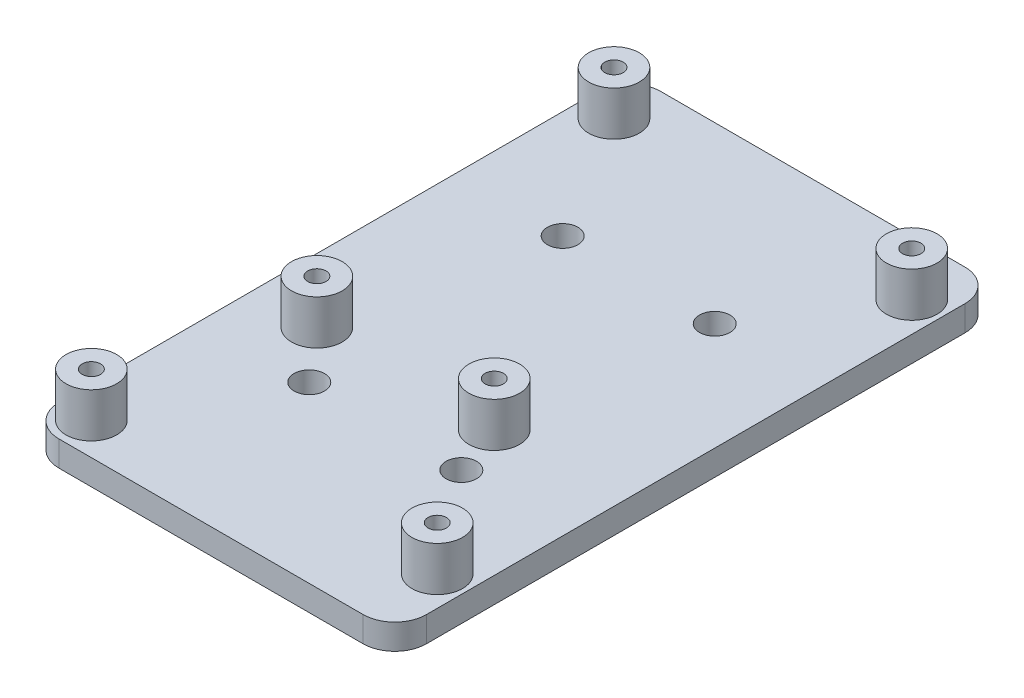
from build123d import *

# Parameters (mm, degrees)
SKETCH1_W           = 58
SKETCH1_H           = 95
BOSS_EXTRUDE1_DEPTH = 4
SKETCH2_R           = 4
SKETCH2_R_2         = 1.45
BOSS_EXTRUDE2_DEPTH = 7
FILLET1_R           = 5
CUT_EXTRUDE1_REACH  = 58.73
SKETCH3_R           = 2.4


with BuildPart() as part:
    # Sketch1 → Boss-Extrude1 (new body)
    with BuildSketch(Plane(origin=(0, 0, 0), x_dir=(1, 0, 0), z_dir=(0, 1, 0))):
        Rectangle(SKETCH1_W, SKETCH1_H)
    extrude(amount=BOSS_EXTRUDE1_DEPTH)

    # Sketch2 → Boss-Extrude2 (add)
    # profile 1 of 6: a face of its own
    with BuildSketch(Plane(origin=(0, 4, 0), x_dir=(1, 0, 0), z_dir=(0, 1, 0))):
        with Locations(Location((-24, 40.1, 0), (0, 0, 270))):
            Circle(SKETCH2_R)
        with Locations(Location((-24, 40.1, 0), (0, 0, 270))):
            Circle(SKETCH2_R_2, mode=Mode.SUBTRACT)
    # profile 2 of 6: a face of its own
    with BuildSketch(Plane(origin=(0, 4, 0), x_dir=(1, 0, 0), z_dir=(0, 1, 0))):
        with Locations(Location((24.25, 38.85, 0), (0, 0, 270))):
            Circle(SKETCH2_R)
        with Locations(Location((24.25, 38.85, 0), (0, 0, 270))):
            Circle(SKETCH2_R_2, mode=Mode.SUBTRACT)
    # profile 3 of 6: a face of its own
    with BuildSketch(Plane(origin=(0, 4, 0), x_dir=(1, 0, 0), z_dir=(0, 1, 0))):
        with Locations(Location((-18.9, -11.9, 0), (0, 0, 270))):
            Circle(SKETCH2_R)
        with Locations(Location((-18.9, -11.9, 0), (0, 0, 270))):
            Circle(SKETCH2_R_2, mode=Mode.SUBTRACT)
    # profile 4 of 6: a face of its own
    with BuildSketch(Plane(origin=(0, 4, 0), x_dir=(1, 0, 0), z_dir=(0, 1, 0))):
        with Locations(Location((9.1, -11.9, 0), (0, 0, 270))):
            Circle(SKETCH2_R)
        with Locations(Location((9.1, -11.9, 0), (0, 0, 270))):
            Circle(SKETCH2_R_2, mode=Mode.SUBTRACT)
    # profile 5 of 6: a face of its own
    with BuildSketch(Plane(origin=(0, 4, 0), x_dir=(1, 0, 0), z_dir=(0, 1, 0))):
        with Locations(Location((-24, -42.4, 0), (0, 0, 270))):
            Circle(SKETCH2_R)
        with Locations(Location((-24, -42.4, 0), (0, 0, 270))):
            Circle(SKETCH2_R_2, mode=Mode.SUBTRACT)
    # profile 6 of 6: a face of its own
    with BuildSketch(Plane(origin=(0, 4, 0), x_dir=(1, 0, 0), z_dir=(0, 1, 0))):
        with Locations(Location((24.3, -36.1, 0), (0, 0, 270))):
            Circle(SKETCH2_R)
        with Locations(Location((24.3, -36.1, 0), (0, 0, 270))):
            Circle(SKETCH2_R_2, mode=Mode.SUBTRACT)
    extrude(amount=BOSS_EXTRUDE2_DEPTH)

    # Fillet1
    fillet1_edges = [part.edges().sort_by_distance(p)[0] for p in [
        (29, 2, 47.5),
        (-29, 2, 47.5),
        (-29, 2, -47.5),
        (29, 2, -47.5),
    ]]
    fillet(fillet1_edges, radius=FILLET1_R)

    # Sketch3 → Cut-Extrude1 (cut, up to next)
    with BuildSketch(Plane(origin=(0, 0, 0), x_dir=(1, 0, 0), z_dir=(0, 1, 0)), mode=Mode.PRIVATE) as cut_extrude1_sk1:
        with Locations(Location((-12, 20, 0), (0, 0, 270))):
            Circle(SKETCH3_R)
    cut_extrude1_tool1 = extrude(cut_extrude1_sk1.sketch, amount=CUT_EXTRUDE1_REACH, mode=Mode.PRIVATE) & part.part
    # Sketch3 → Cut-Extrude1 (cut, up to next)
    with BuildSketch(Plane(origin=(0, 0, 0), x_dir=(1, 0, 0), z_dir=(0, 1, 0)), mode=Mode.PRIVATE) as cut_extrude1_sk2:
        with Locations(Location((12, 20, 0), (0, 0, 270))):
            Circle(SKETCH3_R)
    cut_extrude1_tool2 = extrude(cut_extrude1_sk2.sketch, amount=CUT_EXTRUDE1_REACH, mode=Mode.PRIVATE) & part.part
    # Sketch3 → Cut-Extrude1 (cut, up to next)
    with BuildSketch(Plane(origin=(0, 0, 0), x_dir=(1, 0, 0), z_dir=(0, 1, 0)), mode=Mode.PRIVATE) as cut_extrude1_sk3:
        with Locations(Location((-12, -20, 0), (0, 0, 270))):
            Circle(SKETCH3_R)
    cut_extrude1_tool3 = extrude(cut_extrude1_sk3.sketch, amount=CUT_EXTRUDE1_REACH, mode=Mode.PRIVATE) & part.part
    # Sketch3 → Cut-Extrude1 (cut, up to next)
    with BuildSketch(Plane(origin=(0, 0, 0), x_dir=(1, 0, 0), z_dir=(0, 1, 0)), mode=Mode.PRIVATE) as cut_extrude1_sk4:
        with Locations(Location((12, -20, 0), (0, 0, 270))):
            Circle(SKETCH3_R)
    cut_extrude1_tool4 = extrude(cut_extrude1_sk4.sketch, amount=CUT_EXTRUDE1_REACH, mode=Mode.PRIVATE) & part.part
    add(cut_extrude1_tool1.solids().sort_by_distance((-12, 0, -20))[0], mode=Mode.SUBTRACT)
    add(cut_extrude1_tool2.solids().sort_by_distance((12, 0, -20))[0], mode=Mode.SUBTRACT)
    add(cut_extrude1_tool3.solids().sort_by_distance((-12, 0, 20))[0], mode=Mode.SUBTRACT)
    add(cut_extrude1_tool4.solids().sort_by_distance((12, 0, 20))[0], mode=Mode.SUBTRACT)


solid = part.part
